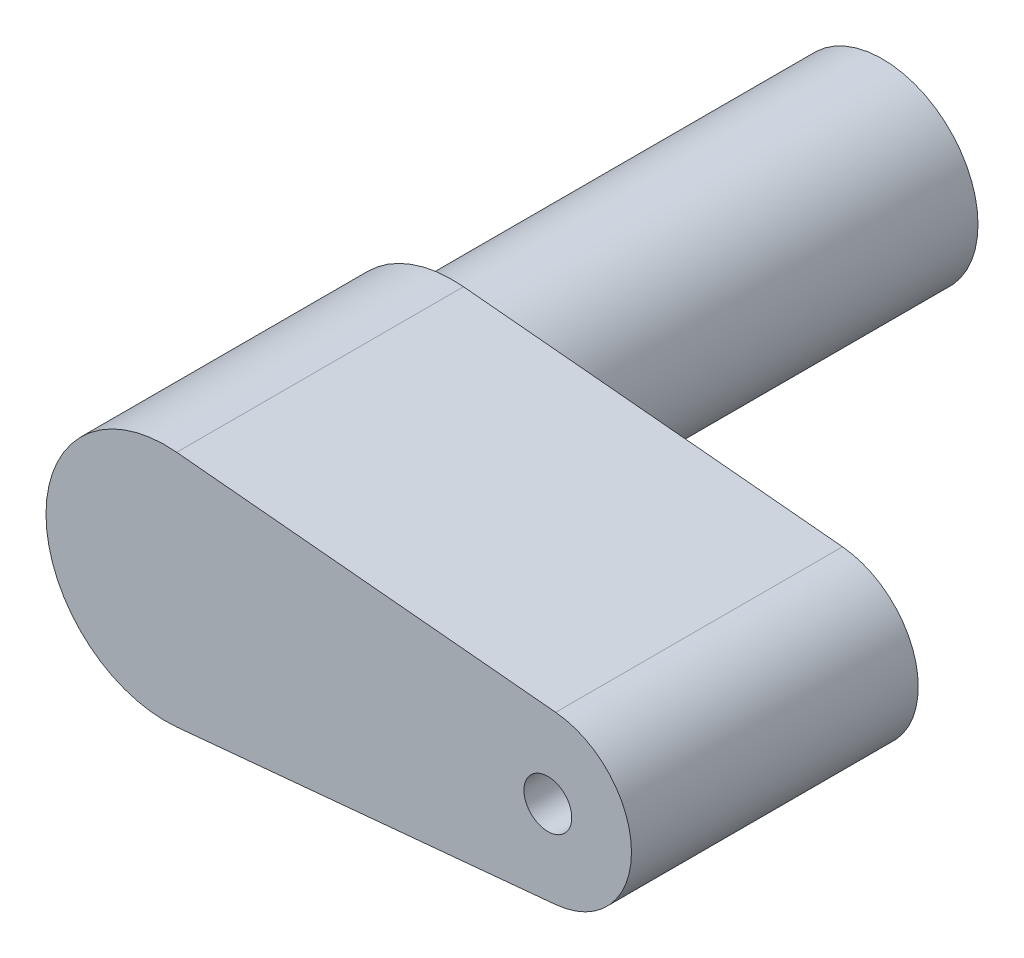
from build123d import *

# Parameters (mm, degrees)
SKETCH1_R           = 4
SKETCH1_R_2         = 1.25
BOSS_EXTRUDE1_DEPTH = 30
BOSS_EXTRUDE2_DEPTH = 12
SKETCH3_R           = 1
CUT_EXTRUDE1_DEPTH  = 12


with BuildPart() as part:
    # Sketch1 → Boss-Extrude1 (new body)
    with BuildSketch(Plane.XY):
        with Locations((0, 491.000207075)):
            Circle(SKETCH1_R)
        with Locations((0, 491.000207075)):
            Circle(SKETCH1_R_2, mode=Mode.SUBTRACT)
    extrude(amount=BOSS_EXTRUDE1_DEPTH)

    # Sketch2 → Boss-Extrude2 (add)
    with BuildSketch(Plane.XY.offset(30)):
        with BuildLine():
            Line((0.46875, 495.978185926), (16.328125, 494.484792271))
            ThreePointArc((16.328125, 494.484792271), (19.5, 491.000207075), (16.328125, 487.51562188))
            Line((16.328125, 487.51562188), (0.46875, 486.022228224))
            ThreePointArc((0.46875, 486.022228224), (-5, 491.000207075), (0.46875, 495.978185926))
        make_face()
    extrude(amount=-BOSS_EXTRUDE2_DEPTH)

    # Sketch3 → Cut-Extrude1 (cut)
    with BuildSketch(Plane.XY.offset(30)):
        with Locations((16, 491.000207075)):
            Circle(SKETCH3_R)
    extrude(amount=-CUT_EXTRUDE1_DEPTH, mode=Mode.SUBTRACT)


solid = part.part
